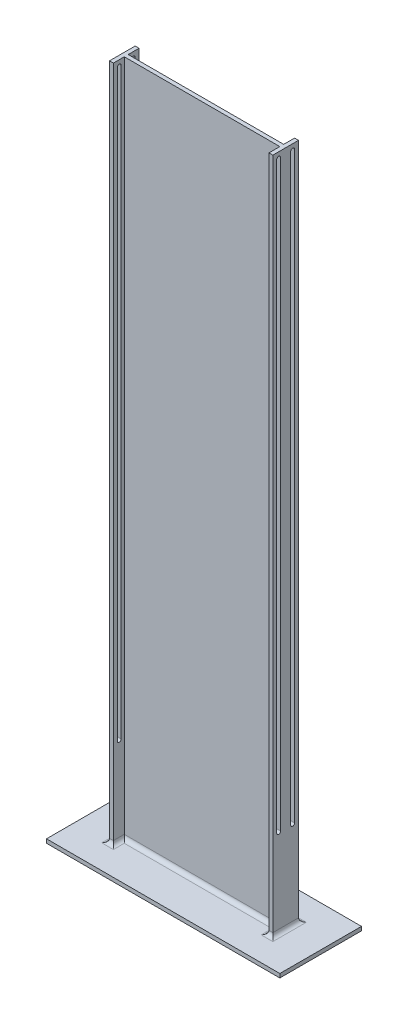
from build123d import *

# Parameters (mm, degrees)
WALL_EXTRUDE_DEPTH           = 200
RIGHT_GUIDE_EXTRUDE_DEPTH    = 10
SKETCH3_W                    = 600
SKETCH3_H                    = 210
BOTTOM_FOOT_COMPLETION_DEPTH = 10
SKETCH4_W                    = 400
SKETCH4_H                    = 10
PLATFORM_STOPPER_DEPTH       = 28
STRUCTURAL_FILLETS_R         = 10


with BuildPart() as part:
    # Sketch1 → Wall extrude (new, symmetric)
    with BuildSketch(Plane(origin=(0, 0, 0), x_dir=(0, 0, -1), z_dir=(1, 0, 0))):
        Polygon((0, 0), (-100, 0), (-100, -10), (10, -10), (110, -10), (110, 0), (10, 0), (10, 1741.5), (0, 1741.5), align=None)
    extrude(amount=WALL_EXTRUDE_DEPTH, both=True)

    # Sketch2 → Right guide extrude (add)
    with BuildSketch(Plane(origin=(200, 0, 0), x_dir=(0, 0, -1), z_dir=(1, 0, 0))):
        Polygon((0, 1741.5), (38, 1741.5), (38, -10), (0, -10), (-28, -10), (-28, 1741.5), align=None)
        with BuildLine():
            Line((18, 226.5), (18, 1726.5))
            ThreePointArc((18, 1726.5), (23, 1731.5), (28, 1726.5))
            Line((28, 1726.5), (28, 226.5))
            ThreePointArc((28, 226.5), (23, 221.5), (18, 226.5))
        make_face(mode=Mode.SUBTRACT)
        with BuildLine():
            Line((-18, 1726.5), (-18, 226.5))
            ThreePointArc((-18, 226.5), (-13, 221.5), (-8, 226.5))
            Line((-8, 226.5), (-8, 1726.5))
            ThreePointArc((-8, 1726.5), (-13, 1731.5), (-18, 1726.5))
        make_face(mode=Mode.SUBTRACT)
    right_guide_extrude = extrude(amount=RIGHT_GUIDE_EXTRUDE_DEPTH)

    # Left guide extrude: Right guide extrude across plane
    add(right_guide_extrude.mirror(Plane(origin=(0, 0, 0), x_dir=(0, 0, 1), z_dir=(1, 0, 0))))

    # Sketch3 → Bottom foot completion (add)
    with BuildSketch(Plane.XZ.offset(10)):
        with Locations((0, -5)):
            Rectangle(SKETCH3_W, SKETCH3_H)
    extrude(amount=-BOTTOM_FOOT_COMPLETION_DEPTH)

    # Sketch4 → Platform stopper (add)
    with BuildSketch(Plane(origin=(0, 0, -10), x_dir=(-1, 0, 0), z_dir=(0, 0, -1))):
        with Locations((0, 131.5)):
            Rectangle(SKETCH4_W, SKETCH4_H)
    extrude(amount=PLATFORM_STOPPER_DEPTH)

    # Structural fillets
    structural_fillets_edges = [part.edges().sort_by_distance(p)[0] for p in [
        (205, 0, 28),
        (205, 0, -38),
        (210, 0, -5),
        (-205, 0, -38),
        (-210, 0, -5),
        (-205, 0, 28),
        (-200, 0, 14),
        (-200, 126.5, -24),
        (200, 126.5, -24),
        (0, 126.5, -10),
        (0, 0, -10),
        (0, 0, 0),
        (200, 0, -24),
        (-200, 0, -24),
        (200, 0, 14),
    ]]
    fillet(structural_fillets_edges, radius=STRUCTURAL_FILLETS_R)


solid = part.part
